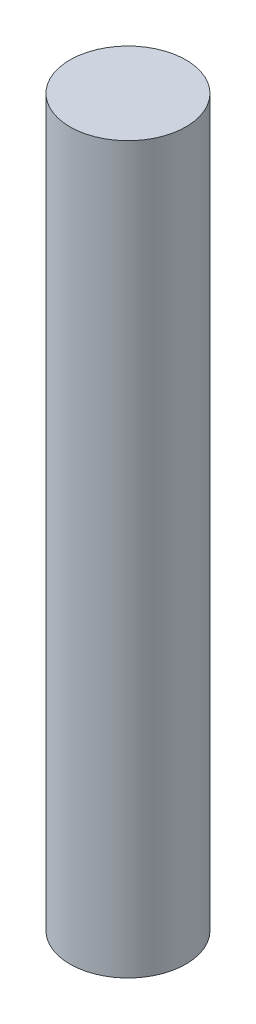
from build123d import *

# Parameters (mm, degrees)
SKETCH1_R           = 4.572
BOSS_EXTRUDE1_DEPTH = 57.15


with BuildPart() as part:
    # Sketch1 → Boss-Extrude1 (new body)
    with BuildSketch(Plane(origin=(0, 0, 0), x_dir=(1, 0, 0), z_dir=(0, 1, 0))):
        with Locations(Location((0, 0, 0), (0, 0, 270))):
            Circle(SKETCH1_R)
    extrude(amount=BOSS_EXTRUDE1_DEPTH)


solid = part.part
